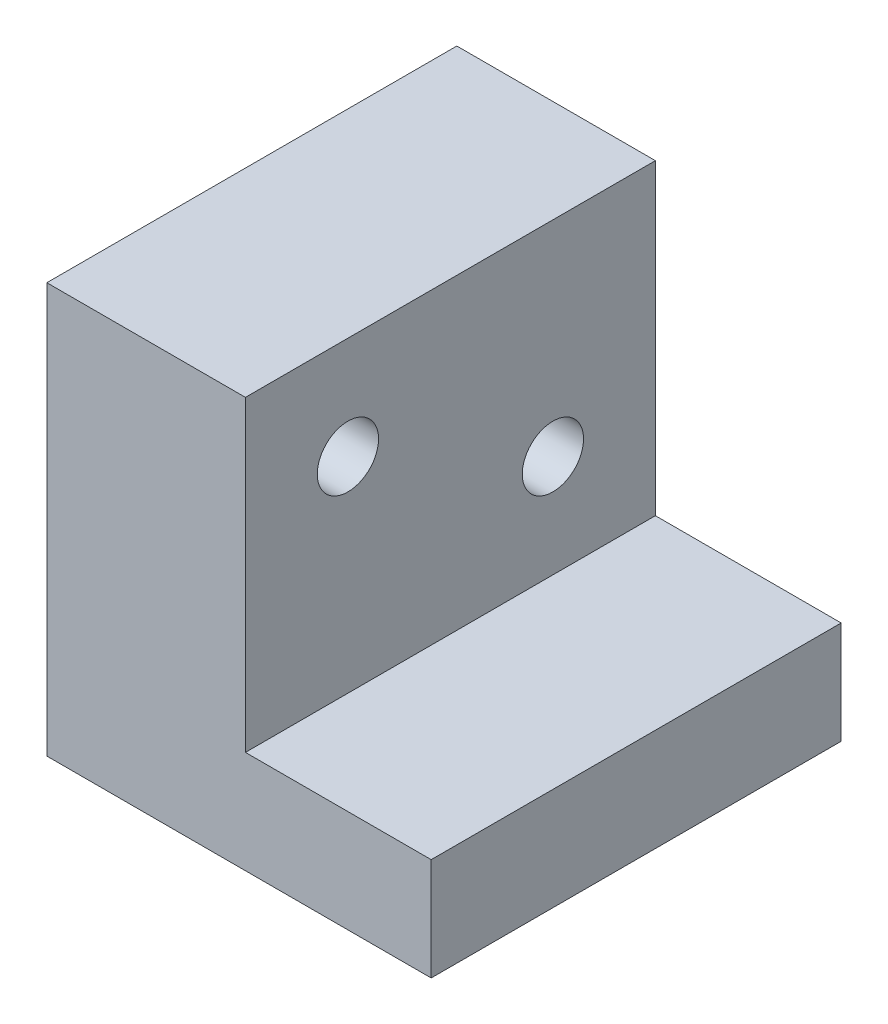
from build123d import *

# Parameters (mm, degrees)
SKETCH1_W              = 25.4
SKETCH1_H              = 25.4
EXTRUDE1_DEPTH         = 23.8125
SKETCH2_W              = 11.509375
SKETCH2_H              = 19.05
EXTRUDE2_DEPTH         = 38.060560658
F_10_24_TAPPED_HOLE1_D = 3.7973


with BuildPart() as part:
    # Sketch1 → Extrude1 (new body)
    with BuildSketch(Plane(origin=(0, 0, 0), x_dir=(0, 0, -1), z_dir=(1, 0, 0))):
        Rectangle(SKETCH1_W, SKETCH1_H)
    extrude(amount=-EXTRUDE1_DEPTH)

    # Sketch2 → Extrude2 (cut, through all)
    with BuildSketch(Plane.XY.offset(12.7)):
        with Locations((-5.7546875, 3.175)):
            Rectangle(SKETCH2_W, SKETCH2_H)
    extrude(amount=-EXTRUDE2_DEPTH, mode=Mode.SUBTRACT)

    # #10-24 Tapped Hole1 (through all)
    with Locations(Plane(origin=(0, 0, 0), x_dir=(0, 0, -1), z_dir=(1, 0, 0))):
        with Locations((6.35, 0), (-6.35, 6.35)):
            Hole(F_10_24_TAPPED_HOLE1_D / 2)


solid = part.part
